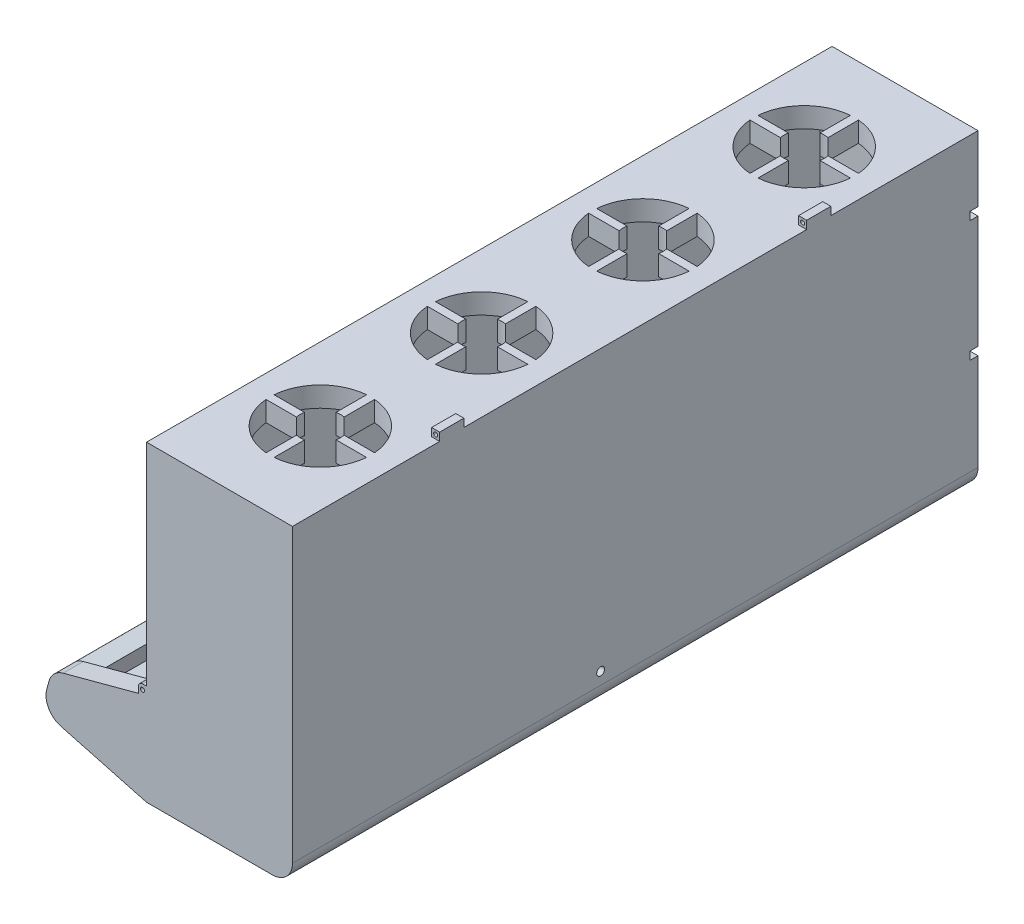
from build123d import *

# Parameters (mm, degrees)
BOSS_EXTRUDE1_DEPTH  = 80
SKETCH2_R            = 2.5
CUT_EXTRUDE1_DEPTH   = 2.5
BOSS_EXTRUDE2_DEPTH  = 2.5
BOSS_EXTRUDE3_DEPTH  = 2.5
BOSS_EXTRUDE4_DEPTH  = 2.5
BOSS_EXTRUDE5_DEPTH  = 2.5
SKETCH9_W            = 16.845592895
SKETCH9_H            = 85
BOSS_EXTRUDE10_DEPTH = 2.5
SKETCH12_W           = 18.095592895
SKETCH12_H           = 85
SKETCH12_W_2         = 14.095592895
SKETCH12_H_2         = 81
BOSS_EXTRUDE13_DEPTH = 12.5
SKETCH13_W           = 18.095592895
SKETCH13_H           = 85
BOSS_EXTRUDE14_DEPTH = 2.5
BOSS_EXTRUDE15_DEPTH = 80
BOSS_EXTRUDE16_START = -85
BOSS_EXTRUDE16_DEPTH = 85
BOSS_EXTRUDE17_DEPTH = 85
BOSS_EXTRUDE18_DEPTH = 2.5
BOSS_EXTRUDE19_DEPTH = 2.5
SKETCH10_W           = 3.154880332
SKETCH10_H           = 41.259228163
SKETCH10_W_2         = 2.154880332
SKETCH10_H_2         = 40.259228163
BOSS_EXTRUDE21_DEPTH = 2.5
SKETCH23_W           = 3.154880332
SKETCH23_H           = 41.259228163
BOSS_EXTRUDE22_DEPTH = 0.5
SKETCH24_W           = 41.259228163
SKETCH24_H           = 3
CUT_EXTRUDE4_DEPTH   = 0.5
SKETCH25_W           = 40.259228163
SKETCH25_H           = 0.5
BOSS_EXTRUDE23_DEPTH = 2.154880332
SKETCH26_W           = 0.4120503
SKETCH26_H           = 0.175346223
BOSS_EXTRUDE24_DEPTH = 2.154880332
SKETCH27_R           = 0.538600154
BOSS_EXTRUDE25_DEPTH = 0.25
SKETCH28_W           = 1.258556527
SKETCH28_H           = 1.071333243
BOSS_EXTRUDE26_DEPTH = 0.25
SKETCH29_W           = 41.259228163
SKETCH29_H           = 3
SKETCH29_W_2         = 40.259228163
SKETCH29_H_2         = 2
BOSS_EXTRUDE27_DEPTH = 1.25
SKETCH32_W           = 5.550653448
SKETCH32_H           = 26.341781721
BOSS_EXTRUDE28_DEPTH = 0.5
SKETCH33_W           = 1.615548123
SKETCH33_H           = 2.790492212
SKETCH33_H_2         = 3.818568291
SKETCH33_H_3         = 4.185738318
SKETCH33_H_4         = 3.671700279
BOSS_EXTRUDE29_DEPTH = 0.25
SKETCH31_W           = 80
SKETCH31_H           = 7.225807592
BOSS_EXTRUDE30_DEPTH = 0.25
SKETCH34_W           = 1
SKETCH34_H           = 24.703961963
BOSS_EXTRUDE31_DEPTH = 80
CUT_EXTRUDE6_REACH   = 101.25
CUT_EXTRUDE7_DEPTH   = 85
SKETCH40_W           = 3
SKETCH40_H           = 1
BOSS_EXTRUDE32_DEPTH = 1
CUT_EXTRUDE8_REACH   = 79.816
SKETCH41_R           = 0.25
CUT_EXTRUDE10_DEPTH  = 2.5
BOSS_EXTRUDE33_DEPTH = 80
SKETCH51_R           = 0.75
CUT_EXTRUDE13_DEPTH  = 7.5
SKETCH52_R           = 0.75
SKETCH52_R_2         = 0.492472666
BOSS_EXTRUDE37_DEPTH = 2.5
BOSS_EXTRUDE38_DEPTH = 2.5
BOSS_EXTRUDE39_DEPTH = 2.5
CUT_EXTRUDE15_START  = -85
SKETCH55_R           = 0.25
CUT_EXTRUDE15_DEPTH  = 85
SKETCH57_W           = 1
SKETCH57_H           = 1
CUT_EXTRUDE16_DEPTH  = 18.095592895
CUT_EXTRUDE17_DEPTH  = 85
SKETCH59_R           = 0.5
CUT_EXTRUDE18_DEPTH  = 4.5


with BuildPart() as part:
    # Sketch1 → Boss-Extrude1 (new body)
    with BuildSketch(Plane.XY):
        Polygon((0, 0), (0, 25), (-15.595592895, 25), (-15.595592895, 27.5), (2.5, 27.5), (2.5, -1.443375673), (-14.345592895, -11.169183265), (-15.595592895, -9.004119756), align=None)
    extrude(amount=BOSS_EXTRUDE1_DEPTH)

    # Sketch2 → Cut-Extrude1 (cut)
    with BuildSketch(Plane(origin=(0, 27.5, 0), x_dir=(1, 0, 0), z_dir=(0, 1, 0))):
        with Locations(Location((-6.547796447, -10, 0), (0, 0, 180))):
            Circle(SKETCH2_R)
        with Locations(Location((-6.547796447, -30, 0), (0, 0, 180))):
            Circle(SKETCH2_R)
        with Locations(Location((-6.547796447, -50, 0), (0, 0, 180))):
            Circle(SKETCH2_R)
        with Locations(Location((-6.547796447, -70, 0), (0, 0, 180))):
            Circle(SKETCH2_R)
    extrude(amount=-CUT_EXTRUDE1_DEPTH, mode=Mode.SUBTRACT)

    # Sketch3 → Boss-Extrude2 (add)
    with BuildSketch(Plane(origin=(0, 0, 0), x_dir=(-1, 0, 0), z_dir=(0, 0, -1))):
        Polygon((15.595592895, 25), (15.595592895, -9.004119756), (15.595592895, -11.169183265), (14.345592895, -11.169183265), (-2.5, -1.443375673), (-2.5, 27.5), (15.595592895, 27.5), align=None)
    extrude(amount=BOSS_EXTRUDE2_DEPTH)

    # Sketch4 → Boss-Extrude3 (add)
    with BuildSketch(Plane.XY.offset(80)):
        Polygon((-15.595592895, 25), (-15.595592895, -9.004119756), (-15.595592895, -11.169183265), (-14.345592895, -11.169183265), (2.5, -1.443375673), (2.5, 27.5), (-15.595592895, 27.5), align=None)
    extrude(amount=BOSS_EXTRUDE3_DEPTH)

    # Sketch6 → Boss-Extrude4 (add)
    with BuildSketch(Plane(origin=(0, 0, -2.5), x_dir=(-1, 0, 0), z_dir=(0, 0, -1))):
        Polygon((14.345592895, -11.169183265), (-2.5, -11.169183265), (-2.5, -1.443375673), align=None)
    extrude(amount=-BOSS_EXTRUDE4_DEPTH)

    # Sketch7 → Boss-Extrude5 (add)
    with BuildSketch(Plane.XY.offset(82.5)):
        Polygon((2.5, -1.443375673), (-14.345592895, -11.169183265), (2.5, -11.169183265), align=None)
    extrude(amount=-BOSS_EXTRUDE5_DEPTH)

    # Sketch9 → Boss-Extrude10 (add)
    with BuildSketch(Plane.XZ.offset(11.169183265)):
        with Locations((-5.922796448, 40)):
            Rectangle(SKETCH9_W, SKETCH9_H)
    extrude(amount=-BOSS_EXTRUDE10_DEPTH)

    # Sketch12 → Boss-Extrude13 (add)
    with BuildSketch(Plane(origin=(0, 27.5, 0), x_dir=(1, 0, 0), z_dir=(0, 1, 0))):
        with Locations((-6.547796448, -40)):
            Rectangle(SKETCH12_W, SKETCH12_H)
        with Locations((-6.547796448, -40)):
            Rectangle(SKETCH12_W_2, SKETCH12_H_2, mode=Mode.SUBTRACT)
    extrude(amount=BOSS_EXTRUDE13_DEPTH)

    # Sketch13 → Boss-Extrude14 (add)
    with BuildSketch(Plane(origin=(0, 40, 0), x_dir=(1, 0, 0), z_dir=(0, 1, 0))):
        with Locations((-6.547796448, -40)):
            Rectangle(SKETCH13_W, SKETCH13_H)
    extrude(amount=BOSS_EXTRUDE14_DEPTH)

    # Sketch15 → Boss-Extrude15 (add)
    with BuildSketch(Plane(origin=(0, 0, 80), x_dir=(-1, 0, 0), z_dir=(0, 0, -1))):
        Polygon((15.595592895, -11.169183265), (15.595592895, -9.004119756), (14.345592895, -11.169183265), align=None)
    extrude(amount=BOSS_EXTRUDE15_DEPTH)

    # Sketch16 → Boss-Extrude16 (add)
    with BuildSketch(Plane(origin=(0, 0, -2.5), x_dir=(-1, 0, 0), z_dir=(0, 0, -1)).offset(BOSS_EXTRUDE16_START)):
        Polygon((15.595592895, -11.169183265), (28.624824068, -7.678011294), (27.977776456, -5.263196729), (15.595592895, -8.580992814), align=None)
    extrude(amount=BOSS_EXTRUDE16_DEPTH)

    # Sketch17 → Boss-Extrude17 (add)
    with BuildSketch(Plane(origin=(0, 0, -2.5), x_dir=(-1, 0, 0), z_dir=(0, 0, -1))):
        Polygon((27.977776456, -5.263196729), (27.330728843, -2.848382163), (24.915914277, -3.495429776), (25.56296189, -5.910244341), align=None)
    extrude(amount=-BOSS_EXTRUDE17_DEPTH)

    # Sketch18 → Boss-Extrude18 (add)
    with BuildSketch(Plane(origin=(0, 0, -2.5), x_dir=(-1, 0, 0), z_dir=(0, 0, -1))):
        Polygon((27.330728843, -2.848382163), (15.595592895, 0.296038037), (15.595592895, -8.580992814), (25.56296189, -5.910244341), (24.915914277, -3.495429776), align=None)
    extrude(amount=-BOSS_EXTRUDE18_DEPTH)

    # Sketch19 → Boss-Extrude19 (add)
    with BuildSketch(Plane.XY.offset(82.5)):
        Polygon((-15.595592895, 0.296038037), (-27.330728843, -2.848382163), (-24.915914277, -3.495429776), (-25.56296189, -5.910244341), (-15.595592895, -8.580992814), align=None)
    extrude(amount=-BOSS_EXTRUDE19_DEPTH)

    # Sketch10 → Boss-Extrude21 (add)
    with BuildSketch(Plane(origin=(0, -8.669183265, 0), x_dir=(1, 0, 0), z_dir=(0, 1, 0))):
        with Locations((-1.577440166, -20.735564423)):
            Rectangle(SKETCH10_W, SKETCH10_H)
        with Locations((-1.577440166, -20.735564423)):
            Rectangle(SKETCH10_W_2, SKETCH10_H_2, mode=Mode.SUBTRACT)
    extrude(amount=BOSS_EXTRUDE21_DEPTH)

    # Sketch23 → Boss-Extrude22 (add)
    with BuildSketch(Plane(origin=(0, -6.169183265, 0), x_dir=(1, 0, 0), z_dir=(0, 1, 0))):
        with Locations((-1.577440166, -20.735564423)):
            Rectangle(SKETCH23_W, SKETCH23_H)
    extrude(amount=BOSS_EXTRUDE22_DEPTH)

    # Sketch24 → Cut-Extrude4 (cut)
    with BuildSketch(Plane(origin=(0, 0, 0), x_dir=(0, 0, -1), z_dir=(1, 0, 0))):
        with Locations((-20.735564423, -7.169183265)):
            Rectangle(SKETCH24_W, SKETCH24_H)
    extrude(amount=-CUT_EXTRUDE4_DEPTH, mode=Mode.SUBTRACT)

    # Sketch25 → Boss-Extrude23 (add)
    with BuildSketch(Plane(origin=(-2.654880332, 0, 0), x_dir=(0, 0, -1), z_dir=(1, 0, 0))):
        with Locations((-20.735564423, -8.419183265)):
            Rectangle(SKETCH25_W, SKETCH25_H)
    extrude(amount=BOSS_EXTRUDE23_DEPTH)

    # Sketch26 → Boss-Extrude24 (add)
    with BuildSketch(Plane(origin=(-0.5, 0, 0), x_dir=(0, 0, -1), z_dir=(1, 0, 0))):
        with Locations((-20.721813924, -8.081510154)):
            Rectangle(SKETCH26_W, SKETCH26_H)
    extrude(amount=-BOSS_EXTRUDE24_DEPTH)

    # Sketch27 → Boss-Extrude25 (add)
    with BuildSketch(Plane.XY.offset(0.605950341)):
        with Locations((-1.171433265, -7.412117688)):
            Circle(SKETCH27_R)
    extrude(amount=BOSS_EXTRUDE25_DEPTH)

    # Sketch28 → Boss-Extrude26 (add)
    with BuildSketch(Plane(origin=(0, 0, 40.865178504), x_dir=(-1, 0, 0), z_dir=(0, 0, -1))):
        with Locations((1.040236357, -7.383777754)):
            Rectangle(SKETCH28_W, SKETCH28_H)
    extrude(amount=BOSS_EXTRUDE26_DEPTH)

    # Sketch29 → Boss-Extrude27 (add)
    with BuildSketch(Plane(origin=(-0.5, 0, 0), x_dir=(0, 0, -1), z_dir=(1, 0, 0))):
        with Locations((-20.735564423, -7.169183265)):
            Rectangle(SKETCH29_W, SKETCH29_H)
        with Locations((-20.735564423, -7.169183265)):
            Rectangle(SKETCH29_W_2, SKETCH29_H_2, mode=Mode.SUBTRACT)
    extrude(amount=BOSS_EXTRUDE27_DEPTH)

    # Sketch32 → Boss-Extrude28 (add)
    with BuildSketch(Plane(origin=(0, -8.669183265, 0), x_dir=(1, 0, 0), z_dir=(0, 1, 0))):
        with Locations((-2.775326724, -62.853430373)):
            Rectangle(SKETCH32_W, SKETCH32_H)
    extrude(amount=BOSS_EXTRUDE28_DEPTH)

    # Sketch33 → Boss-Extrude29 (add)
    with BuildSketch(Plane(origin=(0, -8.169183265, 0), x_dir=(1, 0, 0), z_dir=(0, 1, 0))):
        with Locations((-2.214540617, -52.031497307)):
            Rectangle(SKETCH33_W, SKETCH33_H)
        with Locations((-2.214540617, -56.584405653)):
            Rectangle(SKETCH33_W, SKETCH33_H_2)
        with Locations((-2.214540617, -62.34897509)):
            Rectangle(SKETCH33_W, SKETCH33_H_3)
        with Locations((-2.214540617, -68.407280551)):
            Rectangle(SKETCH33_W, SKETCH33_H_4)
    extrude(amount=BOSS_EXTRUDE29_DEPTH)

    # Sketch31 → Boss-Extrude30 (add)
    with BuildSketch(Plane(origin=(2.5, 0, 0), x_dir=(0, 0, -1), z_dir=(1, 0, 0))):
        with Locations((-40, -5.056279469)):
            Rectangle(SKETCH31_W, SKETCH31_H)
    extrude(amount=-BOSS_EXTRUDE30_DEPTH)

    # Cut-Extrude6: up to this face of the body (flat: up to its plane)
    cut_extrude6_end = Plane(part.part.faces().sort_by_distance((-7.905140486, 13.675334486, 82.5))[0])
    # Sketch38 → Cut-Extrude6 (cut, up to the picked face)
    with BuildSketch(Plane(origin=(0, 0, -2.5), x_dir=(-1, 0, 0), z_dir=(0, 0, -1)), mode=Mode.PRIVATE) as cut_extrude6_sk1:
        with BuildLine():
            Line((-2.5, 40), (-2.5, 42.5))
            Line((-2.5, 42.5), (0, 42.5))
            ThreePointArc((0, 42.5), (-1.767766953, 41.767766953), (-2.5, 40))
        make_face()
    cut_extrude6_tool1 = split(extrude(cut_extrude6_sk1.sketch, amount=-CUT_EXTRUDE6_REACH, mode=Mode.PRIVATE), bisect_by=cut_extrude6_end, keep=Keep.BOTH, mode=Mode.PRIVATE)
    # Sketch38 → Cut-Extrude6 (cut, up to the picked face)
    with BuildSketch(Plane(origin=(0, 0, -2.5), x_dir=(-1, 0, 0), z_dir=(0, 0, -1)), mode=Mode.PRIVATE) as cut_extrude6_sk2:
        with BuildLine():
            Line((13.095592895, 42.5), (15.595592895, 42.5))
            Line((15.595592895, 42.5), (15.595592895, 40))
            ThreePointArc((15.595592895, 40), (14.863359848, 41.767766953), (13.095592895, 42.5))
        make_face()
    cut_extrude6_tool2 = split(extrude(cut_extrude6_sk2.sketch, amount=-CUT_EXTRUDE6_REACH, mode=Mode.PRIVATE), bisect_by=cut_extrude6_end, keep=Keep.BOTH, mode=Mode.PRIVATE)
    # Sketch38 → Cut-Extrude6 (cut, up to the picked face)
    with BuildSketch(Plane(origin=(0, 0, -2.5), x_dir=(-1, 0, 0), z_dir=(0, 0, -1)), mode=Mode.PRIVATE) as cut_extrude6_sk3:
        with BuildLine():
            Line((26.210009503, -8.325058907), (28.624824068, -7.678011294))
            Line((28.624824068, -7.678011294), (27.977776456, -5.263196729))
            ThreePointArc((27.977776456, -5.263196729), (27.728025399, -7.160244341), (26.210009503, -8.325058907))
        make_face()
    cut_extrude6_tool3 = split(extrude(cut_extrude6_sk3.sketch, amount=-CUT_EXTRUDE6_REACH, mode=Mode.PRIVATE), bisect_by=cut_extrude6_end, keep=Keep.BOTH, mode=Mode.PRIVATE)
    # Sketch38 → Cut-Extrude6 (cut, up to the picked face)
    with BuildSketch(Plane(origin=(0, 0, -2.5), x_dir=(-1, 0, 0), z_dir=(0, 0, -1)), mode=Mode.PRIVATE) as cut_extrude6_sk4:
        with BuildLine():
            Line((25.936535003, -2.47480905), (27.330728843, -2.848382163))
            Line((27.330728843, -2.848382163), (27.704301956, -4.242576002))
            ThreePointArc((27.704301956, -4.242576002), (27.057254343, -3.121856662), (25.936535003, -2.47480905))
        make_face()
    cut_extrude6_tool4 = split(extrude(cut_extrude6_sk4.sketch, amount=-CUT_EXTRUDE6_REACH, mode=Mode.PRIVATE), bisect_by=cut_extrude6_end, keep=Keep.BOTH, mode=Mode.PRIVATE)
    add(cut_extrude6_tool1.solids().sort_by(Axis((1.94158, 41.94158, -2.5), (0, 0, 1)))[0], mode=Mode.SUBTRACT)
    add(cut_extrude6_tool2.solids().sort_by(Axis((-15.037173, 41.94158, -2.5), (0, 0, 1)))[0], mode=Mode.SUBTRACT)
    add(cut_extrude6_tool3.solids().sort_by(Axis((-27.940902, -7.283149, -2.5), (0, 0, 1)))[0], mode=Mode.SUBTRACT)
    add(cut_extrude6_tool4.solids().sort_by(Axis((-27.116586, -3.062525, -2.5), (0, 0, 1)))[0], mode=Mode.SUBTRACT)

    # Sketch39 → Cut-Extrude7 (cut)
    with BuildSketch(Plane(origin=(0, 0, -2.5), x_dir=(-1, 0, 0), z_dir=(0, 0, -1))):
        with BuildLine():
            Line((-2.5, 27.5), (15.595592895, 27.5))
            Line((15.595592895, 27.5), (15.595592895, 40))
            ThreePointArc((15.595592895, 40), (14.863359848, 41.767766953), (13.095592895, 42.5))
            Line((13.095592895, 42.5), (0, 42.5))
            ThreePointArc((0, 42.5), (-1.767766953, 41.767766953), (-2.5, 40))
            Line((-2.5, 40), (-2.5, 27.5))
        make_face()
    extrude(amount=-CUT_EXTRUDE7_DEPTH, mode=Mode.SUBTRACT)

    # Sketch40 → Boss-Extrude32 (add)
    with BuildSketch(Plane(origin=(2.5, 0, 0), x_dir=(0, 0, -1), z_dir=(1, 0, 0))):
        with Locations((-62.75, 28)):
            Rectangle(SKETCH40_W, SKETCH40_H)
        with Locations((-17.25, 28)):
            Rectangle(SKETCH40_W, SKETCH40_H)
    extrude(amount=-BOSS_EXTRUDE32_DEPTH)

    # Cut-Extrude8: up to this face of the body (flat: up to its plane)
    cut_extrude8_end = Plane(part.part.faces().sort_by_distance((2, 28, 64.25))[0])
    # Sketch41 → Cut-Extrude8 (cut, up to the picked face)
    with BuildSketch(Plane(origin=(0, 0, 15.75), x_dir=(-1, 0, 0), z_dir=(0, 0, -1)), mode=Mode.PRIVATE) as cut_extrude8_sk1:
        with Locations((-2, 28)):
            Circle(SKETCH41_R)
    cut_extrude8_tool1 = split(extrude(cut_extrude8_sk1.sketch, amount=-CUT_EXTRUDE8_REACH, mode=Mode.PRIVATE), bisect_by=cut_extrude8_end, keep=Keep.BOTH, mode=Mode.PRIVATE)
    add(cut_extrude8_tool1.solids().sort_by(Axis((2, 28, 15.75), (0, 0, 1)))[0], mode=Mode.SUBTRACT)

    # Sketch42 → Cut-Extrude10 (cut)
    with BuildSketch(Plane(origin=(0, 27.5, 0), x_dir=(1, 0, 0), z_dir=(0, 1, 0))):
        with BuildLine():
            Line((-7.047796447, -3.770032103), (-7.047796447, -7.550510257))
            ThreePointArc((-7.047796447, -7.550510257), (-8.3155634, -8.232233047), (-8.99728619, -9.5))
            Line((-8.99728619, -9.5), (-12.777764345, -9.5))
            ThreePointArc((-12.777764345, -9.5), (-10.96721383, -5.580582618), (-7.047796447, -3.770032103))
        make_face()
        with BuildLine():
            Line((-6.047796447, -3.770032103), (-6.047796447, -7.550510257))
            ThreePointArc((-6.047796447, -7.550510257), (-4.780029494, -8.232233047), (-4.098306705, -9.5))
            Line((-4.098306705, -9.5), (-0.31782855, -9.5))
            ThreePointArc((-0.31782855, -9.5), (-2.128379065, -5.580582618), (-6.047796447, -3.770032103))
        make_face()
        with BuildLine():
            Line((-12.777764345, -10.5), (-8.99728619, -10.5))
            ThreePointArc((-8.99728619, -10.5), (-8.3155634, -11.767766953), (-7.047796447, -12.449489743))
            Line((-7.047796447, -12.449489743), (-7.047796447, -16.229967897))
            ThreePointArc((-7.047796447, -16.229967897), (-10.96721383, -14.419417382), (-12.777764345, -10.5))
        make_face()
        with BuildLine():
            Line((-12.777764345, -29.5), (-8.99728619, -29.5))
            ThreePointArc((-8.99728619, -29.5), (-8.3155634, -28.232233047), (-7.047796447, -27.550510257))
            Line((-7.047796447, -27.550510257), (-7.047796447, -23.770032103))
            ThreePointArc((-7.047796447, -23.770032103), (-10.96721383, -25.580582618), (-12.777764345, -29.5))
        make_face()
        with BuildLine():
            Line((-6.047796447, -32.449489743), (-6.047796447, -36.229967897))
            ThreePointArc((-6.047796447, -36.229967897), (-2.128379065, -34.419417382), (-0.31782855, -30.5))
            Line((-0.31782855, -30.5), (-4.098306705, -30.5))
            ThreePointArc((-4.098306705, -30.5), (-4.780029494, -31.767766953), (-6.047796447, -32.449489743))
        make_face()
        with BuildLine():
            Line((-12.777764345, -30.5), (-8.99728619, -30.5))
            ThreePointArc((-8.99728619, -30.5), (-8.3155634, -31.767766953), (-7.047796447, -32.449489743))
            Line((-7.047796447, -32.449489743), (-7.047796447, -36.229967897))
            ThreePointArc((-7.047796447, -36.229967897), (-10.96721383, -34.419417382), (-12.777764345, -30.5))
        make_face()
        with BuildLine():
            Line((-6.047796447, -23.770032103), (-6.047796447, -27.550510257))
            ThreePointArc((-6.047796447, -27.550510257), (-4.780029494, -28.232233047), (-4.098306705, -29.5))
            Line((-4.098306705, -29.5), (-0.31782855, -29.5))
            ThreePointArc((-0.31782855, -29.5), (-2.128379065, -25.580582618), (-6.047796447, -23.770032103))
        make_face()
        with BuildLine():
            Line((-12.777764345, -49.5), (-8.99728619, -49.5))
            ThreePointArc((-8.99728619, -49.5), (-8.3155634, -48.232233047), (-7.047796447, -47.550510257))
            Line((-7.047796447, -47.550510257), (-7.047796447, -43.770032103))
            ThreePointArc((-7.047796447, -43.770032103), (-10.96721383, -45.580582618), (-12.777764345, -49.5))
        make_face()
        with BuildLine():
            Line((-12.777764345, -50.5), (-8.99728619, -50.5))
            ThreePointArc((-8.99728619, -50.5), (-8.3155634, -51.767766953), (-7.047796447, -52.449489743))
            Line((-7.047796447, -52.449489743), (-7.047796447, -56.229967897))
            ThreePointArc((-7.047796447, -56.229967897), (-10.96721383, -54.419417382), (-12.777764345, -50.5))
        make_face()
        with BuildLine():
            Line((-6.047796447, -43.770032103), (-6.047796447, -47.550510257))
            ThreePointArc((-6.047796447, -47.550510257), (-4.780029494, -48.232233047), (-4.098306705, -49.5))
            Line((-4.098306705, -49.5), (-0.31782855, -49.5))
            ThreePointArc((-0.31782855, -49.5), (-2.128379065, -45.580582618), (-6.047796447, -43.770032103))
        make_face()
        with BuildLine():
            Line((-12.777764345, -69.5), (-8.99728619, -69.5))
            ThreePointArc((-8.99728619, -69.5), (-8.3155634, -68.232233047), (-7.047796447, -67.550510257))
            Line((-7.047796447, -67.550510257), (-7.047796447, -63.770032103))
            ThreePointArc((-7.047796447, -63.770032103), (-10.96721383, -65.580582618), (-12.777764345, -69.5))
        make_face()
        with BuildLine():
            Line((-12.777764345, -70.5), (-8.99728619, -70.5))
            ThreePointArc((-8.99728619, -70.5), (-8.3155634, -71.767766953), (-7.047796447, -72.449489743))
            Line((-7.047796447, -72.449489743), (-7.047796447, -76.229967897))
            ThreePointArc((-7.047796447, -76.229967897), (-10.96721383, -74.419417382), (-12.777764345, -70.5))
        make_face()
        with BuildLine():
            Line((-6.047796447, -63.770032103), (-6.047796447, -67.550510257))
            ThreePointArc((-6.047796447, -67.550510257), (-4.780029494, -68.232233047), (-4.098306705, -69.5))
            Line((-4.098306705, -69.5), (-0.31782855, -69.5))
            ThreePointArc((-0.31782855, -69.5), (-2.128379065, -65.580582618), (-6.047796447, -63.770032103))
        make_face()
        with BuildLine():
            Line((-4.098306705, -10.5), (-0.31782855, -10.5))
            ThreePointArc((-0.31782855, -10.5), (-2.128379065, -14.419417382), (-6.047796447, -16.229967897))
            Line((-6.047796447, -16.229967897), (-6.047796447, -12.449489743))
            ThreePointArc((-6.047796447, -12.449489743), (-4.780029494, -11.767766953), (-4.098306705, -10.5))
        make_face()
        with BuildLine():
            Line((-6.047796447, -52.449489743), (-6.047796447, -56.229967897))
            ThreePointArc((-6.047796447, -56.229967897), (-2.128379065, -54.419417382), (-0.31782855, -50.5))
            Line((-0.31782855, -50.5), (-4.098306705, -50.5))
            ThreePointArc((-4.098306705, -50.5), (-4.780029494, -51.767766953), (-6.047796447, -52.449489743))
        make_face()
        with BuildLine():
            Line((-6.047796447, -72.449489743), (-6.047796447, -76.229967897))
            ThreePointArc((-6.047796447, -76.229967897), (-2.128379065, -74.419417382), (-0.31782855, -70.5))
            Line((-0.31782855, -70.5), (-4.098306705, -70.5))
            ThreePointArc((-4.098306705, -70.5), (-4.780029494, -71.767766953), (-6.047796447, -72.449489743))
        make_face()
    extrude(amount=-CUT_EXTRUDE10_DEPTH, mode=Mode.SUBTRACT)

    # Sketch43 → Boss-Extrude33 (add)
    with BuildSketch(Plane(origin=(0, 0, 80), x_dir=(-1, 0, 0), z_dir=(0, 0, -1))):
        with BuildLine():
            Line((0, 11.032932257), (0, 0))
            Line((0, 0), (9.554799613, -5.516466128))
            ThreePointArc((9.554799613, -5.516466128), (2.56020084, 1.478132644), (0, 11.032932257))
        make_face()
    extrude(amount=BOSS_EXTRUDE33_DEPTH)

    # Sketch51 → Cut-Extrude13 (cut)
    with BuildSketch(Plane(origin=(2.5, 0, 0), x_dir=(0, 0, -1), z_dir=(1, 0, 0))):
        with Locations(Location((-44.287624475, -7.169183265, 0), (0, 0, 90))):
            Circle(SKETCH51_R)
    extrude(amount=-CUT_EXTRUDE13_DEPTH, mode=Mode.SUBTRACT)

    # Sketch52 → Boss-Extrude37 (add)
    with BuildSketch(Plane(origin=(2.5, 0, 0), x_dir=(0, 0, -1), z_dir=(1, 0, 0))):
        with Locations(Location((-44.287624475, -7.169183265, 0), (0, 0, 90))):
            Circle(SKETCH52_R)
        with Locations(Location((-44.287624475, -7.169183265, 0), (0, 0, 90))):
            Circle(SKETCH52_R_2, mode=Mode.SUBTRACT)
    extrude(amount=-BOSS_EXTRUDE37_DEPTH)

    # Sketch53 → Boss-Extrude38 (add)
    with BuildSketch(Plane(origin=(0, 0, -2.5), x_dir=(-1, 0, 0), z_dir=(0, 0, -1))):
        Polygon((15.595592895, 0.296038037), (15.595592895, 1.296038037), (16.595592895, 1.296038037), (16.595592895, 0.028088845), align=None)
    extrude(amount=-BOSS_EXTRUDE38_DEPTH)

    # Sketch54 → Boss-Extrude39 (add)
    with BuildSketch(Plane.XY.offset(82.5)):
        Polygon((-15.595592895, 0.296038037), (-15.595592895, 1.296038037), (-16.595592895, 1.296038037), (-16.595592895, 0.028088845), align=None)
    extrude(amount=-BOSS_EXTRUDE39_DEPTH)

    # Sketch55 → Cut-Extrude15 (cut)
    with BuildSketch(Plane(origin=(0, 0, -2.5), x_dir=(-1, 0, 0), z_dir=(0, 0, -1)).offset(CUT_EXTRUDE15_START)):
        with Locations((16.095592895, 0.662063441)):
            Circle(SKETCH55_R)
        with BuildLine():
            Line((16.595592895, 0.796038037), (16.595592895, 1.296038037))
            Line((16.595592895, 1.296038037), (16.095592895, 1.296038037))
            ThreePointArc((16.095592895, 1.296038037), (16.449146285, 1.149591428), (16.595592895, 0.796038037))
        make_face()
    extrude(amount=CUT_EXTRUDE15_DEPTH, mode=Mode.SUBTRACT)

    # Sketch57 → Cut-Extrude16 (cut)
    with BuildSketch(Plane.ZY.offset(15.595592895)):
        with Locations((-2, 3.830816735)):
            Rectangle(SKETCH57_W, SKETCH57_H)
        with Locations((-2, 18.830816735)):
            Rectangle(SKETCH57_W, SKETCH57_H)
    extrude(amount=-CUT_EXTRUDE16_DEPTH, mode=Mode.SUBTRACT)

    # Sketch58 → Cut-Extrude17 (cut)
    with BuildSketch(Plane(origin=(0, 0, -2.5), x_dir=(-1, 0, 0), z_dir=(0, 0, -1))):
        with BuildLine():
            Line((0, -11.169183265), (-2.5, -11.169183265))
            Line((-2.5, -11.169183265), (-2.5, -8.669183265))
            ThreePointArc((-2.5, -8.669183265), (-1.767766953, -10.436950218), (0, -11.169183265))
        make_face()
    extrude(amount=-CUT_EXTRUDE17_DEPTH, mode=Mode.SUBTRACT)

    # Sketch59 → Cut-Extrude18 (cut)
    with BuildSketch(Plane(origin=(0, 0, -2.5), x_dir=(-1, 0, 0), z_dir=(0, 0, -1))):
        with Locations((1.6, -4.699183265)):
            Circle(SKETCH59_R)
    extrude(amount=-CUT_EXTRUDE18_DEPTH, mode=Mode.SUBTRACT)


with BuildPart() as body_2:
    # Sketch34 → Boss-Extrude31 (new body)
    with BuildSketch(Plane.XY):
        with Locations((-15.095592895, 12.648019018)):
            Rectangle(SKETCH34_W, SKETCH34_H)
    extrude(amount=BOSS_EXTRUDE31_DEPTH)


solid = Compound([part.part, body_2.part])
